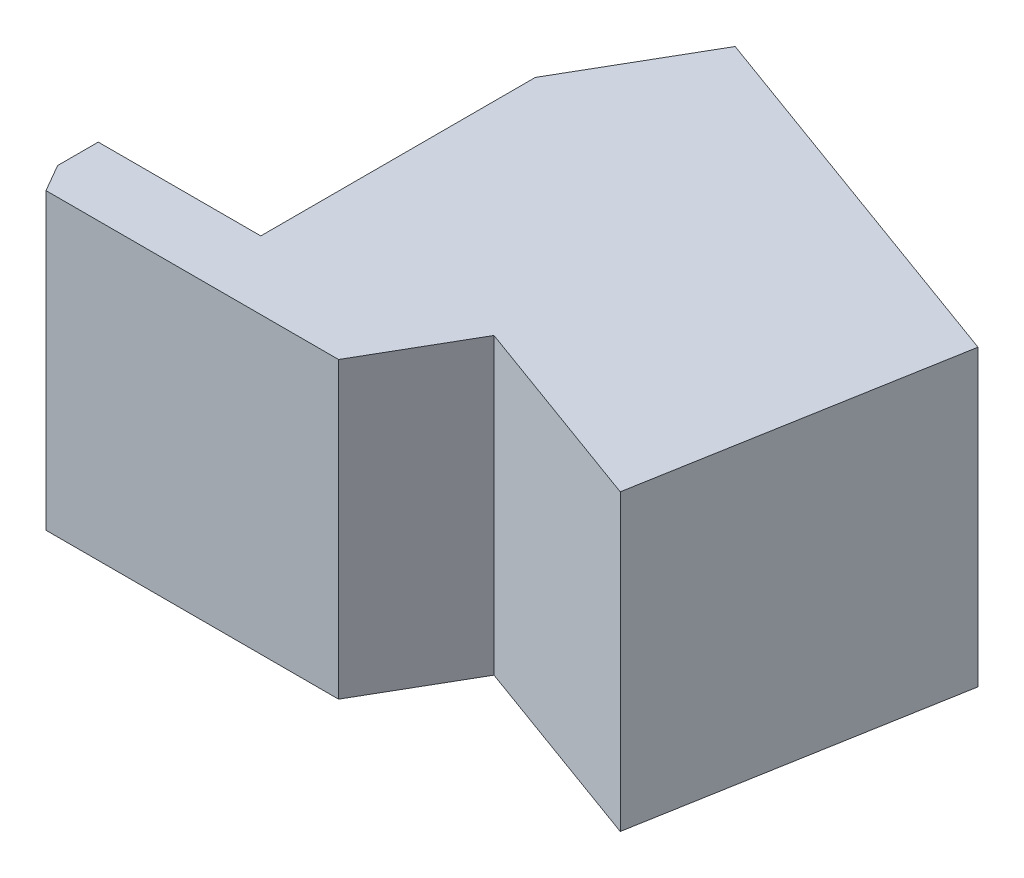
from build123d import *

# Parameters (mm, degrees)
BOSS_EXTRUDE1_DEPTH = 90.5


with BuildPart() as part:
    # Sketch1 → Boss-Extrude1 (new, symmetric)
    with BuildSketch(Plane(origin=(0, 0, 0), x_dir=(1, 0, 0), z_dir=(0, 1, 0))):
        Polygon((-185, -45), (-175.230039262, -61.922068385), (4.769960738, -61.922068385), (39.769960738, -1.300290121), (161.93000144, -45.762908753), (194.923155196, 141.350564319), (-40, 226.855600151), (-85, 148.91331381), (-85, -20), (-185, -20), align=None)
    extrude(amount=BOSS_EXTRUDE1_DEPTH, both=True)


solid = part.part
